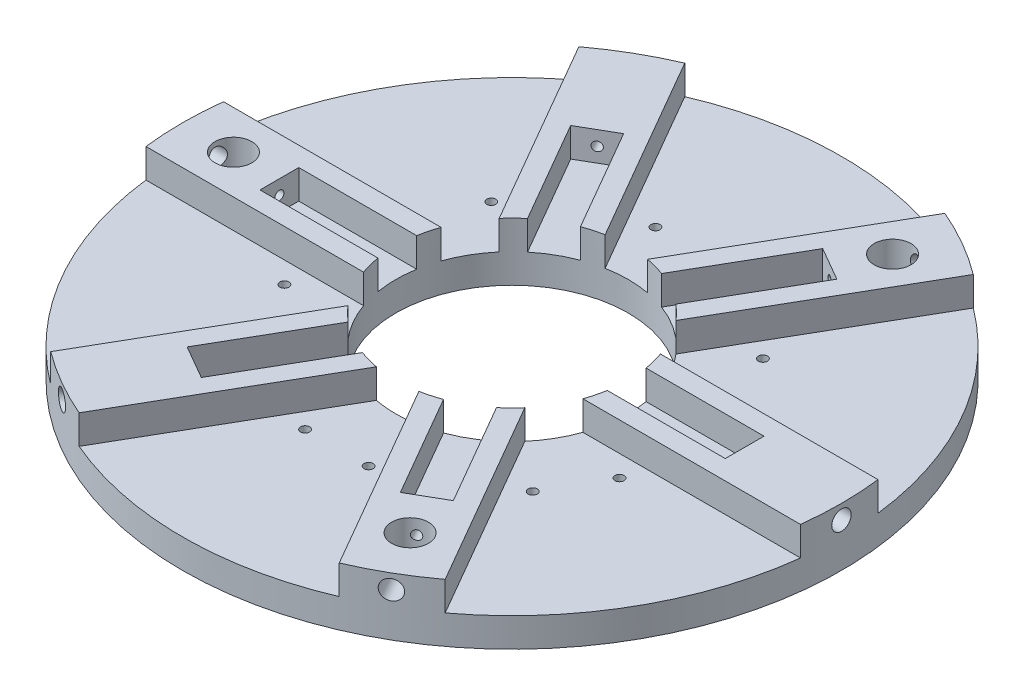
from build123d import *

# Parameters (mm, degrees)
SKETCH1_R                                           = 43.18
BOSS_EXTRUDE1_DEPTH                                 = 7.62
F_97_0_0059_DIAMETER_HOLE1_D                        = 30.48
F_97_0_0059_DIAMETER_HOLE1_DEPTH                    = 25.4
F_97_0_0059_DIAMETER_HOLE1_TIP                      = 9.157115834
CBORE_FOR_00_BINDING_HEAD_MACHINE_SCREW_D           = 2.54
CBORE_FOR_00_BINDING_HEAD_MACHINE_SCREW_CBORE_D     = 4.826
CBORE_FOR_00_BINDING_HEAD_MACHINE_SCREW_CBORE_DEPTH = 6.35
CIRPATTERN1_COUNT                                   = 3
CUT_EXTRUDE1_START                                  = -3.81
CUT_EXTRUDE1_DEPTH                                  = 3.81
CUT_EXTRUDE2_DEPTH                                  = 3.81
CIRPATTERN2_COUNT                                   = 6
F_97_0_0059_DIAMETER_HOLE2_D                        = 2.54
F_97_0_0059_DIAMETER_HOLE2_DEPTH                    = 8.89
CIRPATTERN3_COUNT                                   = 6
F_0_80_TAPPED_HOLE3_D                               = 1.19126
CIRPATTERN4_COUNT                                   = 6
CIRPATTERN4_COPY_1_D                                = 1.19126
CIRPATTERN4_COPY_2_D                                = 1.19126
CIRPATTERN4_COPY_3_D                                = 1.19126
CIRPATTERN4_COPY_4_D                                = 1.19126
CIRPATTERN4_COPY_5_D                                = 1.19126


with BuildPart() as part:
    # Sketch1 → Boss-Extrude1 (new body)
    with BuildSketch(Plane(origin=(0, 0, 0), x_dir=(1, 0, 0), z_dir=(0, 1, 0))):
        with Locations(Location((0, 0, 0), (0, 0, 90))):
            Circle(SKETCH1_R)
    extrude(amount=BOSS_EXTRUDE1_DEPTH)

    # #97 (0.0059) Diameter Hole1
    with Locations(Plane(origin=(0, 7.62, 0), x_dir=(1, 0, 0), z_dir=(0, 1, 0))):
        with Locations((0, 0)):
            Hole(F_97_0_0059_DIAMETER_HOLE1_D / 2, depth=F_97_0_0059_DIAMETER_HOLE1_DEPTH)
            with Locations((0, 0, -(F_97_0_0059_DIAMETER_HOLE1_DEPTH + F_97_0_0059_DIAMETER_HOLE1_TIP / 2))):  # 118° drill point
                Cone(0, F_97_0_0059_DIAMETER_HOLE1_D / 2, F_97_0_0059_DIAMETER_HOLE1_TIP, mode=Mode.SUBTRACT)

    # CBORE for #00 Binding Head Machine Screw1 (through all)
    with Locations(Plane(origin=(0, 7.62, 0), x_dir=(1, 0, 0), z_dir=(0, 1, 0))):
        with Locations((-36.4998, 0)):
            cbore_for_00_binding_head_machine_screw = CounterBoreHole(CBORE_FOR_00_BINDING_HEAD_MACHINE_SCREW_D / 2, CBORE_FOR_00_BINDING_HEAD_MACHINE_SCREW_CBORE_D / 2, CBORE_FOR_00_BINDING_HEAD_MACHINE_SCREW_CBORE_DEPTH)

    # CirPattern1: CBORE for #00 Binding Head Machine Screw1 ×3 about axis
    cirpattern1_axis = Axis((0, 0, 0), (0, 1, 0))
    for i in range(1, CIRPATTERN1_COUNT):
        add(cbore_for_00_binding_head_machine_screw.rotate(cirpattern1_axis, i * 360 / CIRPATTERN1_COUNT), mode=Mode.SUBTRACT)

    # Sketch8 → Cut-Extrude1 (cut)
    with BuildSketch(Plane(origin=(0, 7.62, 0), x_dir=(1, 0, 0), z_dir=(0, 1, 0)).offset(CUT_EXTRUDE1_START)):
        with BuildLine():
            Line((-14.368409794, -5.08), (-42.880135261, -5.08))
            ThreePointArc((-42.880135261, -5.08), (-37.394976935, -21.59), (-25.839476682, -34.595286454))
            Line((-25.839476682, -34.595286454), (-11.583613948, -9.903407893))
            ThreePointArc((-11.583613948, -9.903407893), (-13.198227154, -7.62), (-14.368409794, -5.08))
        make_face()
    cut_extrude1 = extrude(amount=CUT_EXTRUDE1_DEPTH, mode=Mode.SUBTRACT)

    # Sketch9 → Cut-Extrude2 (cut)
    with BuildSketch(Plane(origin=(0, 7.62, 0), x_dir=(1, 0, 0), z_dir=(0, 1, 0))):
        Polygon((0, 0), (0, 2.54), (-30.48, 2.54), (-30.48, -2.54), (0, -2.54), align=None)
    cut_extrude2 = extrude(amount=-CUT_EXTRUDE2_DEPTH, mode=Mode.SUBTRACT)

    # CirPattern2: Cut-Extrude1, Cut-Extrude2 ×6 about axis
    cirpattern2_axis = Axis((0, 0, 0), (0, 1, 0))
    add([cut_extrude1.rotate(cirpattern2_axis, i * 360 / CIRPATTERN2_COUNT) for i in range(1, CIRPATTERN2_COUNT)], mode=Mode.SUBTRACT)
    add([cut_extrude2.rotate(cirpattern2_axis, i * 360 / CIRPATTERN2_COUNT) for i in range(1, CIRPATTERN2_COUNT)], mode=Mode.SUBTRACT)

    # #97 (0.0059) Diameter Hole2
    with Locations(Plane(origin=(-44.150135261, 0, 0), x_dir=(0, 0, -1), z_dir=(-1, 0, 0))):
        with Locations((0, -5.715)):
            f_97_0_0059_diameter_hole2 = Hole(F_97_0_0059_DIAMETER_HOLE2_D / 2, depth=F_97_0_0059_DIAMETER_HOLE2_DEPTH)

    # Sketch12 → #0-80 Tapped Hole2 (revolve, cut)
    with BuildSketch(Plane(origin=(-44.150135261, 5.715, 0), x_dir=(0, 0, 1), z_dir=(0, 1, 0))):
        Polygon((0, 0), (0, 21.947890611), (0.59563, 21.59), (0.59563, 0), align=None)
    f_0_80_tapped_hole2 = revolve(axis=Axis((-50.500135261, 5.715, 0), (1, 0, 0)), mode=Mode.SUBTRACT)

    # CirPattern3: #97 (0.0059) Diameter Hole2, #0-80 Tapped Hole2 ×6 about axis
    cirpattern3_axis = Axis((0, 0, 0), (0, 1, 0))
    add([f_97_0_0059_diameter_hole2.rotate(cirpattern3_axis, i * 360 / CIRPATTERN3_COUNT) for i in range(1, CIRPATTERN3_COUNT)], mode=Mode.SUBTRACT)
    add([f_0_80_tapped_hole2.rotate(cirpattern3_axis, i * 360 / CIRPATTERN3_COUNT) for i in range(1, CIRPATTERN3_COUNT)], mode=Mode.SUBTRACT)

    # #0-80 Tapped Hole3 (through all)
    with Locations(Plane(origin=(0, 3.81, 0), x_dir=(1, 0, 0), z_dir=(0, 1, 0))):
        with Locations((-21.955232806, -7.870444)):
            f_0_80_tapped_hole3 = Hole(F_0_80_TAPPED_HOLE3_D / 2)

    # Mirror1: #0-80 Tapped Hole3 across plane
    add(f_0_80_tapped_hole3.mirror(Plane(origin=(0, 0, 0), x_dir=(1, 0, 0), z_dir=(0, 0, -1))), mode=Mode.SUBTRACT)

    # CirPattern4: #0-80 Tapped Hole3 ×6 about axis
    cirpattern4_axis = Axis((0, 0, 0), (0, 1, 0))
    for i in range(1, CIRPATTERN4_COUNT):
        add(f_0_80_tapped_hole3.rotate(cirpattern4_axis, i * 360 / CIRPATTERN4_COUNT), mode=Mode.SUBTRACT)

    # CirPattern4 copy 1 (through all)
    with Locations(Plane(origin=(0, 3.81, 0), x_dir=(0.49999999999999933, 0, -0.866025403784439), z_dir=(0, 1, 0))):
        with Locations((-21.955232806, 7.870444)):
            Hole(CIRPATTERN4_COPY_1_D / 2)

    # CirPattern4 copy 2 (through all)
    with Locations(Plane(origin=(0, 3.81, 0), x_dir=(-0.5000000000000006, 0, -0.8660254037844383), z_dir=(0, 1, 0))):
        with Locations((-21.955232806, 7.870444)):
            Hole(CIRPATTERN4_COPY_2_D / 2)

    # CirPattern4 copy 3 (through all)
    with Locations(Plane(origin=(0, 3.81, 0), x_dir=(-1, 0, 0), z_dir=(0, 1, 0))):
        with Locations((-21.955232806, 7.870444)):
            Hole(CIRPATTERN4_COPY_3_D / 2)

    # CirPattern4 copy 4 (through all)
    with Locations(Plane(origin=(0, 3.81, 0), x_dir=(-0.49999999999999967, 0, 0.8660254037844388), z_dir=(0, 1, 0))):
        with Locations((-21.955232806, 7.870444)):
            Hole(CIRPATTERN4_COPY_4_D / 2)

    # CirPattern4 copy 5 (through all)
    with Locations(Plane(origin=(0, 3.81, 0), x_dir=(0.5000000000000009, 0, 0.8660254037844382), z_dir=(0, 1, 0))):
        with Locations((-21.955232806, 7.870444)):
            Hole(CIRPATTERN4_COPY_5_D / 2)


solid = part.part
